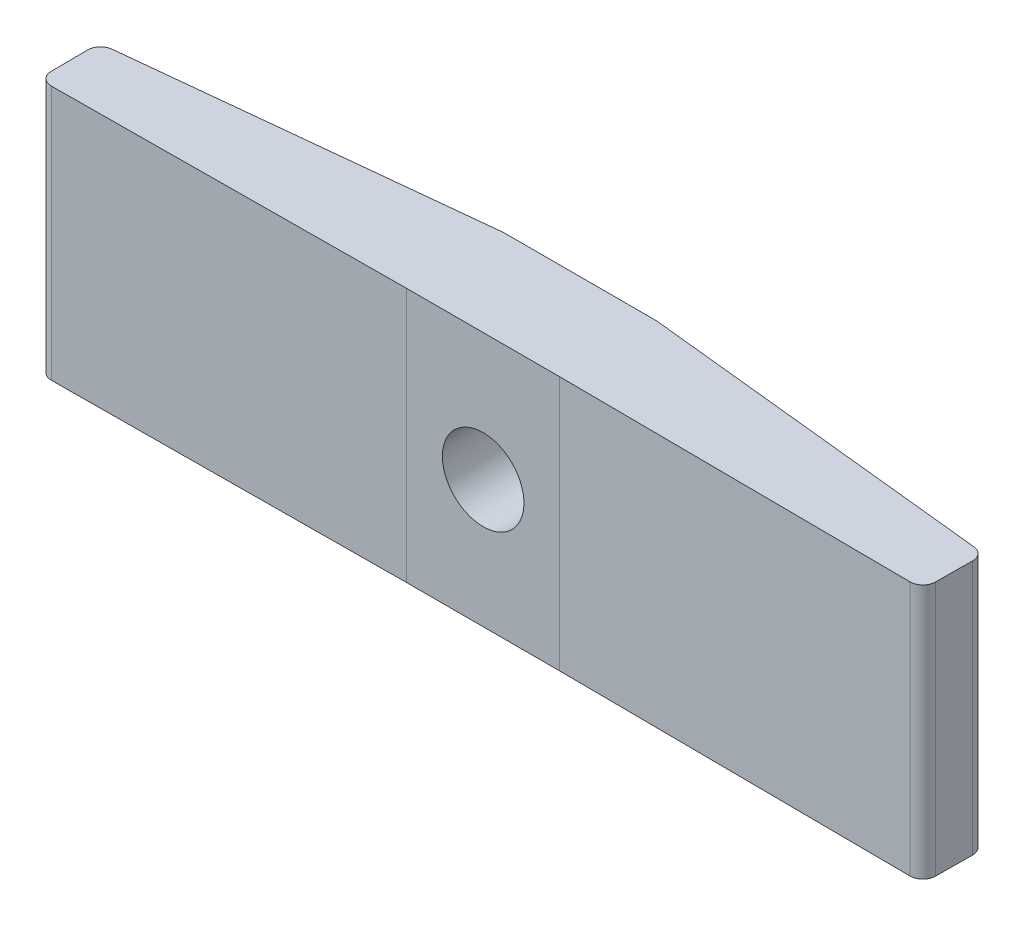
from build123d import *

# Parameters (mm, degrees)
BOSS_EXTRUDE1_DEPTH       = 10
FILLET2_R                 = 0.5
SKETCH2_R                 = 1.6
CUT_EXTRUDE1_DEPTH        = 37.334766384
REVISION_INDICATION_DEPTH = 0.4


with BuildPart() as part:
    # Sketch1 → Boss-Extrude1 (new body)
    with BuildSketch(Plane(origin=(0, 0, 0), x_dir=(1, 0, 0), z_dir=(0, 1, 0))):
        Polygon((20.35, 0.1), (14.35, 0.1), (0, 0), (-0.016724739, 2.4), (14.35, 3.9), (20.35, 3.9), (34.716724739, 2.4), (34.7, 0), align=None)
    extrude(amount=BOSS_EXTRUDE1_DEPTH)

    # Fillet2
    fillet2_edges = [part.edges().sort_by_distance(p)[0] for p in [
        (-0.016724739, 5, -2.4),
        (34.716724739, 5, -2.4),
        (34.7, 5, 0),
        (0, 5, 0),
    ]]
    fillet(fillet2_edges, radius=FILLET2_R)

    # Sketch2 → Cut-Extrude1 (cut, through all)
    with BuildSketch(Plane(origin=(0, 0, -3.9), x_dir=(-1, 0, 0), z_dir=(0, 0, -1))):
        with Locations((-17.35, 5)):
            Circle(SKETCH2_R)
    extrude(amount=-CUT_EXTRUDE1_DEPTH, mode=Mode.SUBTRACT)

    # Sketch5 → revision indication (add)
    with BuildSketch(Plane(origin=(-0.248057274, 0, -2.375847049), x_dir=(-0.9945936530800359, 0, 0.10384346514301955), z_dir=(-0.10384346514301955, 0, -0.9945936530800359))):
        with BuildLine():
            add(Edge.make_bspline(
                [(-1.785308798, 1.976923077), (-1.749947985, 1.974821832), (-1.680627244, 1.970702586), (-1.580407683, 1.942442049), (-1.489703086, 1.892261337), (-1.40890887, 1.825381725), (-1.342312834, 1.744291021), (-1.290343795, 1.654309873), (-1.262329436, 1.553251269), (-1.258240196, 1.483528859), (-1.256142132, 1.44775641)],
                knots=[0, 0, 0, 0, 1.020151414, 1.999887582, 2.974338812, 3.990962822, 5.007586832, 5.987933904, 6.967670073, 8, 8, 8, 8], degree=3))
            add(Edge.make_bspline(
                [(-1.256142132, 1.44775641), (-1.258311293, 1.412843512), (-1.262588847, 1.343995789), (-1.290279579, 1.243699421), (-1.342708899, 1.153662038), (-1.408449529, 1.071471016), (-1.489723058, 1.004449722), (-1.580622123, 0.954695939), (-1.680391977, 0.924411918), (-1.749908735, 0.920554208), (-1.785308798, 0.918589744)],
                knots=[0, 0, 0, 0, 1.009421747, 1.99056486, 2.972319754, 3.999869655, 5.017953583, 5.993804169, 6.978383603, 8, 8, 8, 8], degree=3))
            add(Edge.make_bspline(
                [(-1.785308798, 0.918589744), (-1.82073437, 0.920483127), (-1.889894366, 0.924179507), (-1.989291812, 0.955317742), (-2.080744455, 1.003983162), (-2.162002161, 1.071595984), (-2.228293388, 1.153239101), (-2.278413725, 1.244319503), (-2.308512996, 1.343708683), (-2.312471536, 1.412786963), (-2.314475465, 1.44775641)],
                knots=[0, 0, 0, 0, 1.022052826, 1.995314843, 2.982371812, 4.00089066, 5.028879526, 6.005146991, 6.990147033, 8, 8, 8, 8], degree=3))
            add(Edge.make_bspline(
                [(-2.314475465, 1.44775641), (-2.312548513, 1.483587428), (-2.308786377, 1.553543092), (-2.278350536, 1.653690044), (-2.228682266, 1.744709926), (-2.161543907, 1.825258007), (-2.080764113, 1.892726399), (-1.989512426, 1.941829667), (-1.889654975, 1.970931558), (-1.820694086, 1.974891267), (-1.785308798, 1.976923077)],
                knots=[0, 0, 0, 0, 1.032775665, 2.016367738, 2.991239715, 4.008302682, 5.025365648, 6.011011707, 6.979408107, 8, 8, 8, 8], degree=3))
        make_face()
        with BuildLine():
            add(Edge.make_bspline(
                [(-4.146206234, 1.976923077), (-4.110845421, 1.974821832), (-4.04152468, 1.970702586), (-3.941305118, 1.942442049), (-3.850600522, 1.892261337), (-3.769806306, 1.825381725), (-3.70321027, 1.744291021), (-3.651241231, 1.654309873), (-3.623226872, 1.553251269), (-3.619137632, 1.483528859), (-3.617039568, 1.44775641)],
                knots=[0, 0, 0, 0, 1.020151414, 1.999887582, 2.974338812, 3.990962822, 5.007586832, 5.987933904, 6.967670073, 8, 8, 8, 8], degree=3))
            add(Edge.make_bspline(
                [(-3.617039568, 1.44775641), (-3.619208729, 1.412843512), (-3.623486283, 1.343995789), (-3.651177015, 1.243699421), (-3.703606335, 1.153662038), (-3.769346965, 1.071471016), (-3.850620494, 1.004449722), (-3.941519559, 0.954695939), (-4.041289413, 0.924411918), (-4.110806171, 0.920554208), (-4.146206234, 0.918589744)],
                knots=[0, 0, 0, 0, 1.009421747, 1.99056486, 2.972319754, 3.999869655, 5.017953583, 5.993804169, 6.978383603, 8, 8, 8, 8], degree=3))
            add(Edge.make_bspline(
                [(-4.146206234, 0.918589744), (-4.181631806, 0.920483127), (-4.250791802, 0.924179507), (-4.350189248, 0.955317742), (-4.441641891, 1.003983162), (-4.522899597, 1.071595984), (-4.589190824, 1.153239101), (-4.639311161, 1.244319503), (-4.669410431, 1.343708683), (-4.673368972, 1.412786963), (-4.675372901, 1.44775641)],
                knots=[0, 0, 0, 0, 1.022052826, 1.995314843, 2.982371812, 4.00089066, 5.028879526, 6.005146991, 6.990147033, 8, 8, 8, 8], degree=3))
            add(Edge.make_bspline(
                [(-4.675372901, 1.44775641), (-4.673445949, 1.483587428), (-4.669683813, 1.553543092), (-4.639247972, 1.653690044), (-4.589579702, 1.744709926), (-4.522441343, 1.825258007), (-4.441661549, 1.892726399), (-4.350409862, 1.941829667), (-4.25055241, 1.970931558), (-4.181591522, 1.974891267), (-4.146206234, 1.976923077)],
                knots=[0, 0, 0, 0, 1.032775665, 2.016367738, 2.991239715, 4.008302682, 5.025365648, 6.011011707, 6.979408107, 8, 8, 8, 8], degree=3))
        make_face()
        with BuildLine():
            add(Edge.make_bspline(
                [(-6.50710367, 1.976923077), (-6.471742857, 1.974821832), (-6.402422116, 1.970702586), (-6.302202554, 1.942442049), (-6.211497957, 1.892261337), (-6.130703742, 1.825381725), (-6.064107706, 1.744291021), (-6.012138667, 1.654309873), (-5.984124308, 1.553251269), (-5.980035068, 1.483528859), (-5.977937003, 1.44775641)],
                knots=[0, 0, 0, 0, 1.020151414, 1.999887582, 2.974338812, 3.990962822, 5.007586832, 5.987933904, 6.967670073, 8, 8, 8, 8], degree=3))
            add(Edge.make_bspline(
                [(-5.977937003, 1.44775641), (-5.980106165, 1.412843512), (-5.984383719, 1.343995789), (-6.012074451, 1.243699421), (-6.064503771, 1.153662038), (-6.130244401, 1.071471016), (-6.21151793, 1.004449722), (-6.302416994, 0.954695939), (-6.402186849, 0.924411918), (-6.471703607, 0.920554208), (-6.50710367, 0.918589744)],
                knots=[0, 0, 0, 0, 1.009421747, 1.99056486, 2.972319754, 3.999869655, 5.017953583, 5.993804169, 6.978383603, 8, 8, 8, 8], degree=3))
            add(Edge.make_bspline(
                [(-6.50710367, 0.918589744), (-6.542529242, 0.920483127), (-6.611689237, 0.924179507), (-6.711086684, 0.955317742), (-6.802539327, 1.003983162), (-6.883797033, 1.071595984), (-6.95008826, 1.153239101), (-7.000208597, 1.244319503), (-7.030307867, 1.343708683), (-7.034266408, 1.412786963), (-7.036270337, 1.44775641)],
                knots=[0, 0, 0, 0, 1.022052826, 1.995314843, 2.982371812, 4.00089066, 5.028879526, 6.005146991, 6.990147033, 8, 8, 8, 8], degree=3))
            add(Edge.make_bspline(
                [(-7.036270337, 1.44775641), (-7.034343385, 1.483587428), (-7.030581249, 1.553543092), (-7.000145408, 1.653690044), (-6.950477138, 1.744709926), (-6.883338779, 1.825258007), (-6.802558985, 1.892726399), (-6.711307298, 1.941829667), (-6.611449846, 1.970931558), (-6.542488958, 1.974891267), (-6.50710367, 1.976923077)],
                knots=[0, 0, 0, 0, 1.032775665, 2.016367738, 2.991239715, 4.008302682, 5.025365648, 6.011011707, 6.979408107, 8, 8, 8, 8], degree=3))
        make_face()
        with BuildLine():
            add(Edge.make_bspline(
                [(-8.868001106, 1.976923077), (-8.832640293, 1.974821832), (-8.763319552, 1.970702586), (-8.66309999, 1.942442049), (-8.572395393, 1.892261337), (-8.491601178, 1.825381725), (-8.425005142, 1.744291021), (-8.373036103, 1.654309873), (-8.345021744, 1.553251269), (-8.340932504, 1.483528859), (-8.338834439, 1.44775641)],
                knots=[0, 0, 0, 0, 1.020151414, 1.999887582, 2.974338812, 3.990962822, 5.007586832, 5.987933904, 6.967670073, 8, 8, 8, 8], degree=3))
            add(Edge.make_bspline(
                [(-8.338834439, 1.44775641), (-8.341003601, 1.412843512), (-8.345281155, 1.343995789), (-8.372971887, 1.243699421), (-8.425401207, 1.153662038), (-8.491141837, 1.071471016), (-8.572415366, 1.004449722), (-8.66331443, 0.954695939), (-8.763084284, 0.924411918), (-8.832601042, 0.920554208), (-8.868001106, 0.918589744)],
                knots=[0, 0, 0, 0, 1.009421747, 1.99056486, 2.972319754, 3.999869655, 5.017953583, 5.993804169, 6.978383603, 8, 8, 8, 8], degree=3))
            add(Edge.make_bspline(
                [(-8.868001106, 0.918589744), (-8.903426678, 0.920483127), (-8.972586673, 0.924179507), (-9.07198412, 0.955317742), (-9.163436763, 1.003983162), (-9.244694469, 1.071595984), (-9.310985696, 1.153239101), (-9.361106033, 1.244319503), (-9.391205303, 1.343708683), (-9.395163844, 1.412786963), (-9.397167773, 1.44775641)],
                knots=[0, 0, 0, 0, 1.022052826, 1.995314843, 2.982371812, 4.00089066, 5.028879526, 6.005146991, 6.990147033, 8, 8, 8, 8], degree=3))
            add(Edge.make_bspline(
                [(-9.397167773, 1.44775641), (-9.395240821, 1.483587428), (-9.391478685, 1.553543092), (-9.361042844, 1.653690044), (-9.311374574, 1.744709926), (-9.244236214, 1.825258007), (-9.16345642, 1.892726399), (-9.072204734, 1.941829667), (-8.972347282, 1.970931558), (-8.903386394, 1.974891267), (-8.868001106, 1.976923077)],
                knots=[0, 0, 0, 0, 1.032775665, 2.016367738, 2.991239715, 4.008302682, 5.025365648, 6.011011707, 6.979408107, 8, 8, 8, 8], degree=3))
        make_face()
    extrude(amount=REVISION_INDICATION_DEPTH)


solid = part.part
